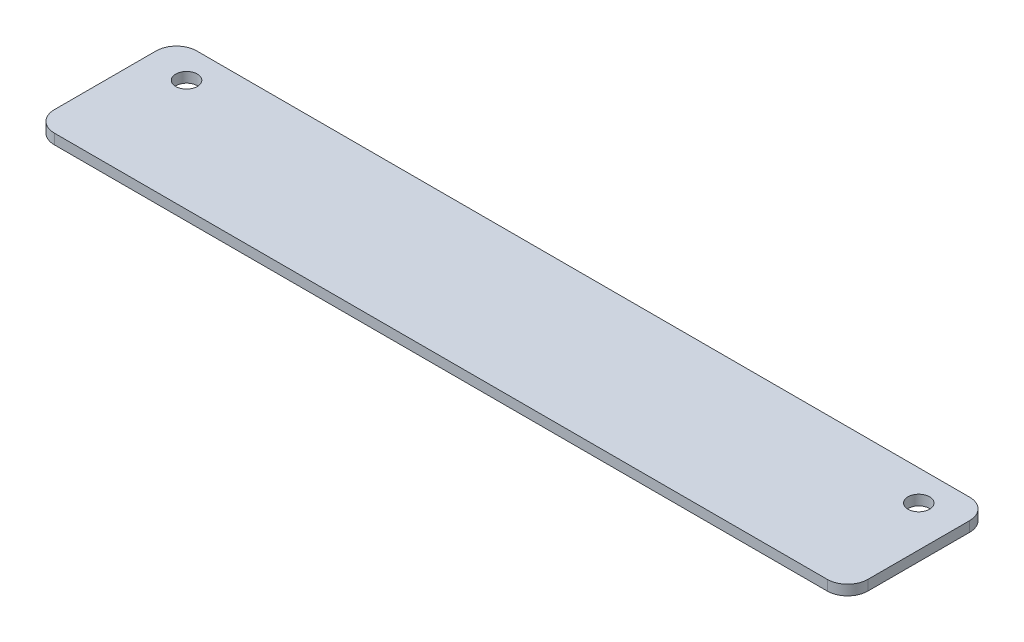
from build123d import *

# Parameters (mm, degrees)
SKETCH1_W                        = 254
SKETCH1_H                        = 44.45
BOSS_EXTRUDE1_DEPTH              = 3.175
FILLET1_R                        = 6.35
F_17_64_0_26563_DIAMETER_HOLE1_D = 6.747002


with BuildPart() as part:
    # Sketch1 → Boss-Extrude1 (new body)
    with BuildSketch(Plane(origin=(0, 0, 0), x_dir=(1, 0, 0), z_dir=(0, 1, 0))):
        with Locations((127, 22.225)):
            Rectangle(SKETCH1_W, SKETCH1_H)
    extrude(amount=BOSS_EXTRUDE1_DEPTH)

    # Fillet1
    fillet1_edges = [part.edges().sort_by_distance(p)[0] for p in [
        (0, 1.5875, -44.45),
        (254, 1.5875, -44.45),
        (254, 1.5875, 0),
        (0, 1.5875, 0),
    ]]
    fillet(fillet1_edges, radius=FILLET1_R)

    # 17/64 (0.26563) Diameter Hole1 (through all)
    with Locations(Plane(origin=(0, 3.175, 0), x_dir=(1, 0, 0), z_dir=(0, 1, 0))):
        with Locations((12.7, 34.925), (241.3, 34.925)):
            Hole(F_17_64_0_26563_DIAMETER_HOLE1_D / 2)


solid = part.part
